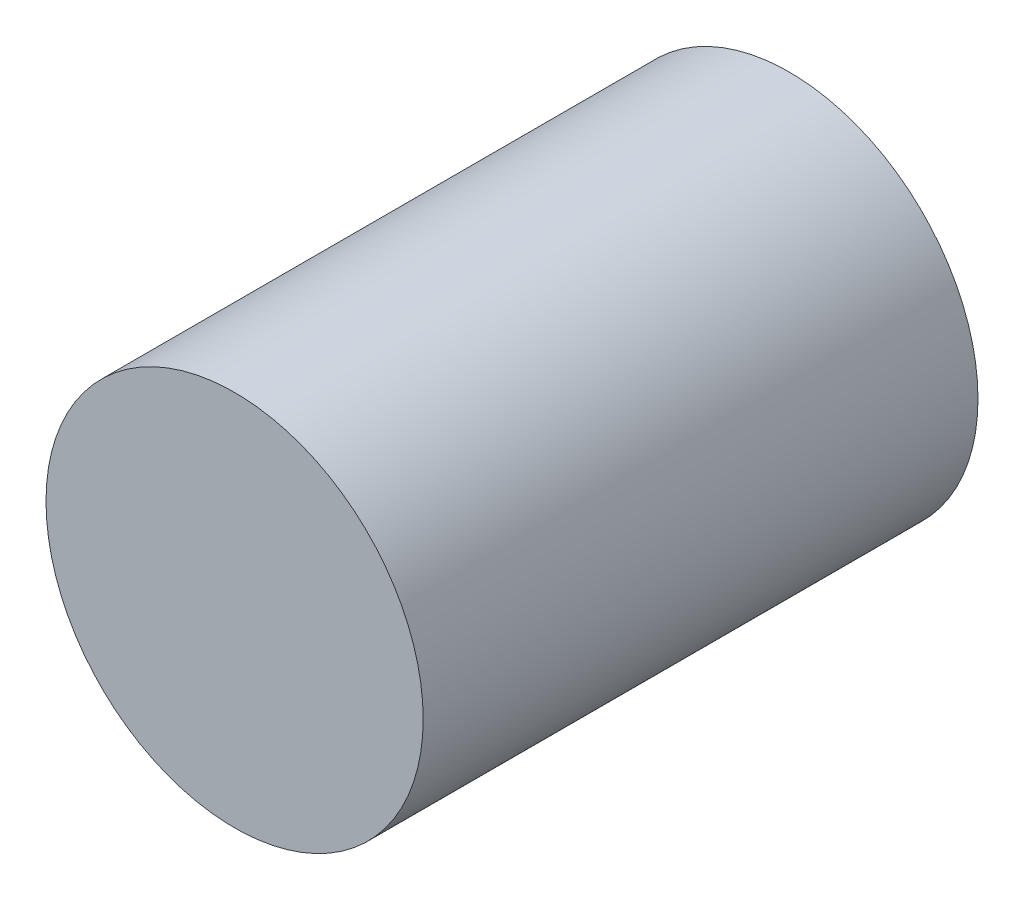
from build123d import *

# Parameters (mm, degrees)
IZIM1_R                     = 27.5
Y_KSEKLIK_EKSTR_ZYON1_DEPTH = 80.9


with BuildPart() as part:
    # Çizim1 → Yükseklik-Ekstrüzyon1 (new body)
    with BuildSketch(Plane.XY):
        Circle(IZIM1_R)
    extrude(amount=Y_KSEKLIK_EKSTR_ZYON1_DEPTH)


solid = part.part
